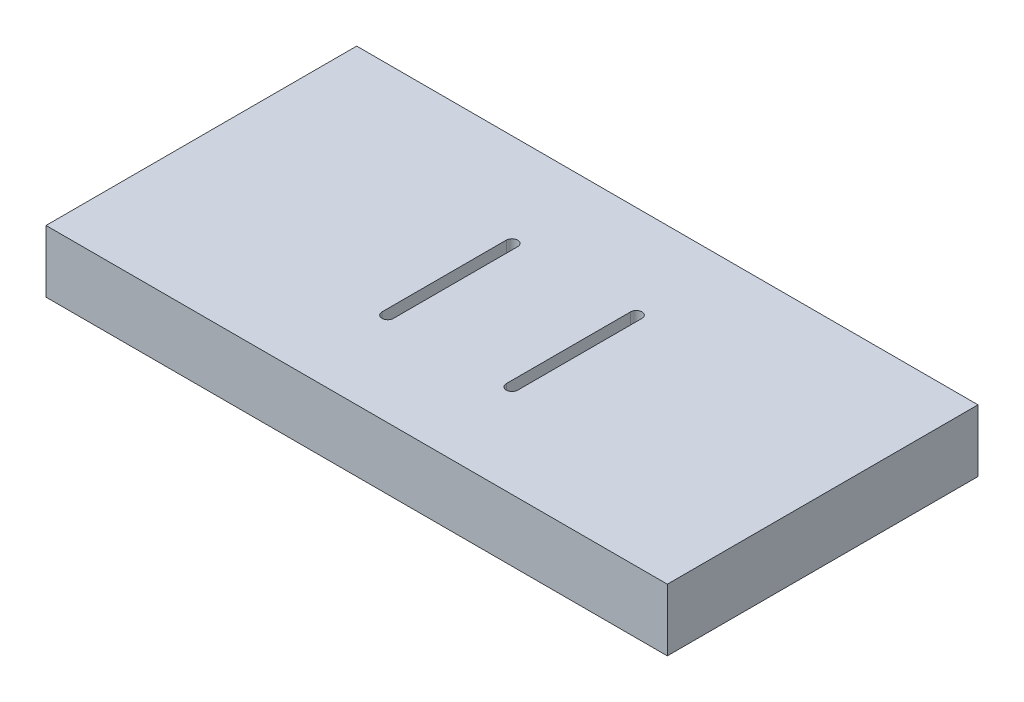
from build123d import *

# Parameters (mm, degrees)
SKETCH1_W                                        = 300
SKETCH1_H                                        = 150
BOSS_EXTRUDE1_DEPTH                              = 30
CUT_EXTRUDE2_DEPTH                               = 30
CBORE_FOR_M5_PAN_HEAD_MACHINE_SCREW1_D           = 5.5
CBORE_FOR_M5_PAN_HEAD_MACHINE_SCREW1_DEPTH       = 110
CBORE_FOR_M5_PAN_HEAD_MACHINE_SCREW1_CBORE_D     = 11
CBORE_FOR_M5_PAN_HEAD_MACHINE_SCREW1_CBORE_DEPTH = 3.7
CUT_EXTRUDE3_DEPTH                               = 10


with BuildPart() as part:
    # Sketch1 → Boss-Extrude1 (new body)
    with BuildSketch(Plane(origin=(0, 0, 0), x_dir=(1, 0, 0), z_dir=(0, 1, 0))):
        Rectangle(SKETCH1_W, SKETCH1_H)
    extrude(amount=BOSS_EXTRUDE1_DEPTH)

    # Sketch4 → Cut-Extrude2 (cut)
    with BuildSketch(Plane(origin=(0, 30, 0), x_dir=(1, 0, 0), z_dir=(0, 1, 0))):
        with BuildLine():
            Line((-32.75, -30), (-32.75, 30))
            ThreePointArc((-32.75, 30), (-30, 32.75), (-27.25, 30))
            Line((-27.25, 30), (-27.25, -30))
            ThreePointArc((-27.25, -30), (-30, -32.75), (-32.75, -30))
        make_face()
        with BuildLine():
            Line((32.75, -30), (32.75, 30))
            ThreePointArc((32.75, 30), (30, 32.75), (27.25, 30))
            Line((27.25, 30), (27.25, -30))
            ThreePointArc((27.25, -30), (30, -32.75), (32.75, -30))
        make_face()
    extrude(amount=-CUT_EXTRUDE2_DEPTH, mode=Mode.SUBTRACT)

    # CBORE for M5 Pan Head Machine Screw1
    with Locations(Plane(origin=(0, 0, 0), x_dir=(-1, 0, 0), z_dir=(0, -1, 0))):
        with Locations((30, -30), (-30, -30)):
            CounterBoreHole(CBORE_FOR_M5_PAN_HEAD_MACHINE_SCREW1_D / 2, CBORE_FOR_M5_PAN_HEAD_MACHINE_SCREW1_CBORE_D / 2, CBORE_FOR_M5_PAN_HEAD_MACHINE_SCREW1_CBORE_DEPTH, depth=CBORE_FOR_M5_PAN_HEAD_MACHINE_SCREW1_DEPTH)

    # Sketch8 → Cut-Extrude3 (cut)
    with BuildSketch(Plane.XZ):
        with BuildLine():
            Line((-24.5, 30), (-24.5, -30))
            ThreePointArc((-24.5, -30), (-30, -35.5), (-35.5, -30))
            Line((-35.5, -30), (-35.5, 30))
            ThreePointArc((-35.5, 30), (-30, 35.5), (-24.5, 30))
        make_face()
        with BuildLine():
            Line((24.5, 30), (24.5, -30))
            ThreePointArc((24.5, -30), (30, -35.5), (35.5, -30))
            Line((35.5, -30), (35.5, 30))
            ThreePointArc((35.5, 30), (30, 35.5), (24.5, 30))
        make_face()
    extrude(amount=-CUT_EXTRUDE3_DEPTH, mode=Mode.SUBTRACT)


solid = part.part
